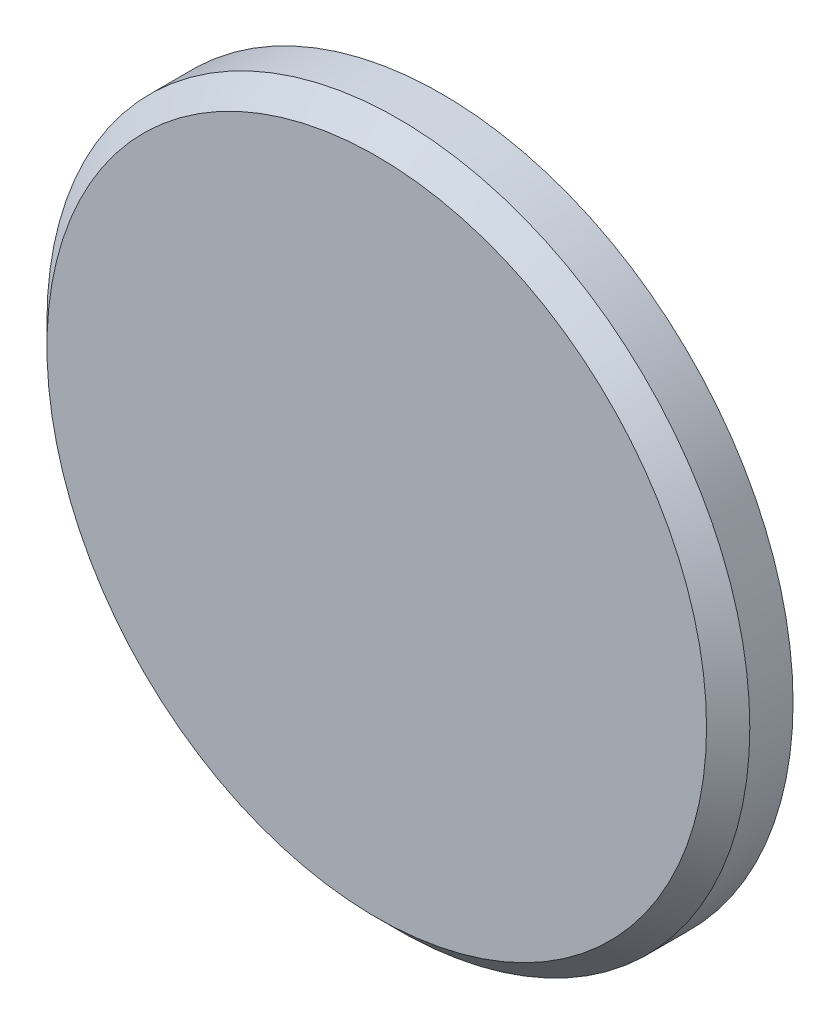
from build123d import *

# Parameters (mm, degrees)
ESQUISSE1_R     = 16.25
COUVERCLE_DEPTH = 3
CHANFREIN_SIZE  = 1


with BuildPart() as part:
    # Esquisse1 → couvercle (new body)
    with BuildSketch(Plane.XY):
        Circle(ESQUISSE1_R)
    extrude(amount=COUVERCLE_DEPTH)

    # Chanfrein
    chanfrein_edges = [part.edges().sort_by_distance(p)[0] for p in [
        (-16.25, 0, 3),
    ]]
    chamfer(chanfrein_edges, length=CHANFREIN_SIZE)


solid = part.part
